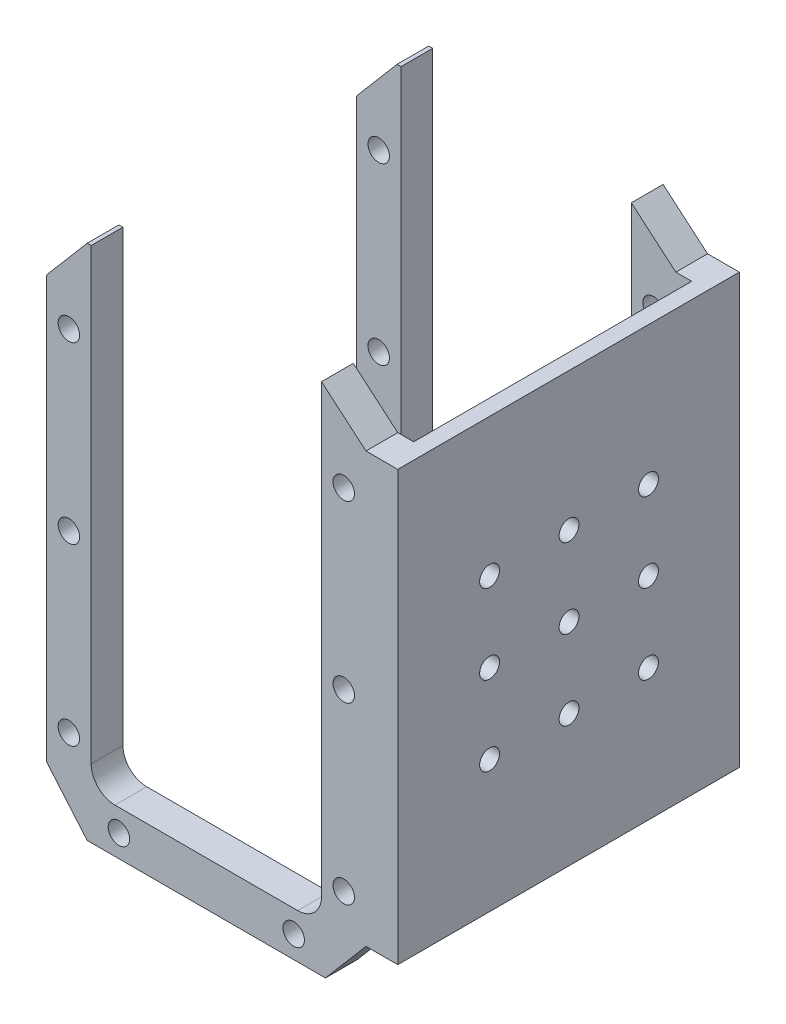
from build123d import *

# Parameters (mm, degrees)
SKETCH_2_R          = 1.35
EXTRUDE_2_DEPTH     = 43
CUT_EXTRUDE_3_DEPTH = 43
SKETCH_6_W          = 4
SKETCH_6_H          = 54
EXTRUDE_3_DEPTH     = 43
SKETCH_7_W          = 2
SKETCH_7_H          = 35
CUT_EXTRUDE_5_DEPTH = 54
SKETCH_8_R          = 1.25
CUT_EXTRUDE_6_DEPTH = 54


with BuildPart() as part:
    # 스케치2 → 보스-돌출2 (new body)
    with BuildSketch(Plane.XY):
        with BuildLine():
            Line((-19.925778092, 26.834933958), (-19.925778092, -26.265066042))
            Line((-19.925778092, -26.265066042), (-14.825778092, -32.265066042))
            Line((-14.825778092, -32.265066042), (15.174221908, -32.265066042))
            Line((15.174221908, -32.265066042), (20.274221908, -26.265066042))
            Line((20.274221908, -26.265066042), (20.274221908, 27.734933958))
            Line((20.274221908, 27.734933958), (14.674221908, 32.494933958))
            Line((14.674221908, 32.494933958), (14.674221908, 29.834933958))
            Line((14.674221908, 29.834933958), (14.674221908, -23.665066042))
            ThreePointArc((14.674221908, -23.665066042), (13.795542252, -25.786386386), (11.674221908, -26.665066042))
            Line((11.674221908, -26.665066042), (-11.325778092, -26.665066042))
            ThreePointArc((-11.325778092, -26.665066042), (-13.447098435, -25.786386386), (-14.325778092, -23.665066042))
            Line((-14.325778092, -23.665066042), (-14.325778092, 29.834933958))
            Line((-14.325778092, 29.834933958), (-14.325778092, 32.834933958))
            Line((-14.325778092, 32.834933958), (-14.825778092, 32.834933958))
            Line((-14.825778092, 32.834933958), (-19.925778092, 26.834933958))
        make_face()
        with Locations((17.474221908, -21.665066042)):
            Circle(SKETCH_2_R, mode=Mode.SUBTRACT)
        with Locations((-17.125778092, 22.334933958)):
            Circle(SKETCH_2_R, mode=Mode.SUBTRACT)
        with Locations((-17.125778092, 0.334933958)):
            Circle(SKETCH_2_R, mode=Mode.SUBTRACT)
        with Locations((-17.125778092, -21.665066042)):
            Circle(SKETCH_2_R, mode=Mode.SUBTRACT)
        with Locations((-10.825778092, -29.465066042)):
            Circle(SKETCH_2_R, mode=Mode.SUBTRACT)
        with Locations((11.174221908, -29.465066042)):
            Circle(SKETCH_2_R, mode=Mode.SUBTRACT)
        with Locations((17.474221908, 0.334933958)):
            Circle(SKETCH_2_R, mode=Mode.SUBTRACT)
        with Locations((17.474221908, 22.334933958)):
            Circle(SKETCH_2_R, mode=Mode.SUBTRACT)
    extrude(amount=EXTRUDE_2_DEPTH)

    # 스케치5 → 컷-돌출3 (cut)
    with BuildSketch(Plane(origin=(20.274221908, 0, 0), x_dir=(0, 0, -1), z_dir=(1, 0, 0))):
        Polygon((-39, 32.834933958), (-39, -26.265066042), (-39, -32.265066042), (-4, -32.265066042), (-4, -26.265066042), (-4, 32.834933958), align=None)
    extrude(amount=-CUT_EXTRUDE_3_DEPTH, mode=Mode.SUBTRACT)


with BuildPart() as cut_extrude_3_piece_1:
    # of the separate pieces the step leaves, piece 1, a body of its own (cut_extrude_3_pieces)
    add(part.part.solids().sort_by_distance((-19.925778092, 26.834933958, 39))[0])



with BuildPart() as cut_extrude_3_piece_2:
    # of the separate pieces the step leaves, piece 2, a body of its own (cut_extrude_3_pieces)
    add(part.part.solids().sort_by_distance((-19.925778092, 26.834933958, 0))[0])


with BuildPart() as cut_extrude_3_piece_1_1:
    add(cut_extrude_3_piece_1.part)

    add(cut_extrude_3_piece_2.part)  # 보스-돌출3 merges 컷-돌출3 piece 2
    # 스케치6 → 보스-돌출3 (add)
    with BuildSketch(Plane.XY.offset(43)):
        with Locations((22.274221908, 0.734933958)):
            Rectangle(SKETCH_6_W, SKETCH_6_H)
    extrude(amount=-EXTRUDE_3_DEPTH)

    # 스케치7 → 컷-돌출5 (cut)
    with BuildSketch(Plane(origin=(0, 27.734933958, 0), x_dir=(1, 0, 0), z_dir=(0, 1, 0))):
        with Locations((21.274221908, -21.5)):
            Rectangle(SKETCH_7_W, SKETCH_7_H)
    extrude(amount=-CUT_EXTRUDE_5_DEPTH, mode=Mode.SUBTRACT)

    # 스케치8 → 컷-돌출6 (cut)
    with BuildSketch(Plane(origin=(24.274221908, 0, 0), x_dir=(0, 0, -1), z_dir=(1, 0, 0))):
        with Locations(Location((-21.442052439, 0.340563404, 0), (0, 0, 90))):
            Circle(SKETCH_8_R)
        with Locations(Location((-31.442052439, 10.340563404, 0), (0, 0, 90))):
            Circle(SKETCH_8_R)
        with Locations(Location((-11.442052439, 0.340563404, 0), (0, 0, 90))):
            Circle(SKETCH_8_R)
        with Locations(Location((-21.442052439, 10.340563404, 0), (0, 0, 90))):
            Circle(SKETCH_8_R)
        with Locations(Location((-31.442052439, 0.340563404, 0), (0, 0, 90))):
            Circle(SKETCH_8_R)
        with Locations(Location((-11.442052439, 10.340563404, 0), (0, 0, 90))):
            Circle(SKETCH_8_R)
        with Locations(Location((-31.442052439, -9.659436596, 0), (0, 0, 90))):
            Circle(SKETCH_8_R)
        with Locations(Location((-21.442052439, -9.659436596, 0), (0, 0, 90))):
            Circle(SKETCH_8_R)
        with Locations(Location((-11.442052439, -9.659436596, 0), (0, 0, 90))):
            Circle(SKETCH_8_R)
    extrude(amount=-CUT_EXTRUDE_6_DEPTH, mode=Mode.SUBTRACT)


solid = cut_extrude_3_piece_1_1.part
